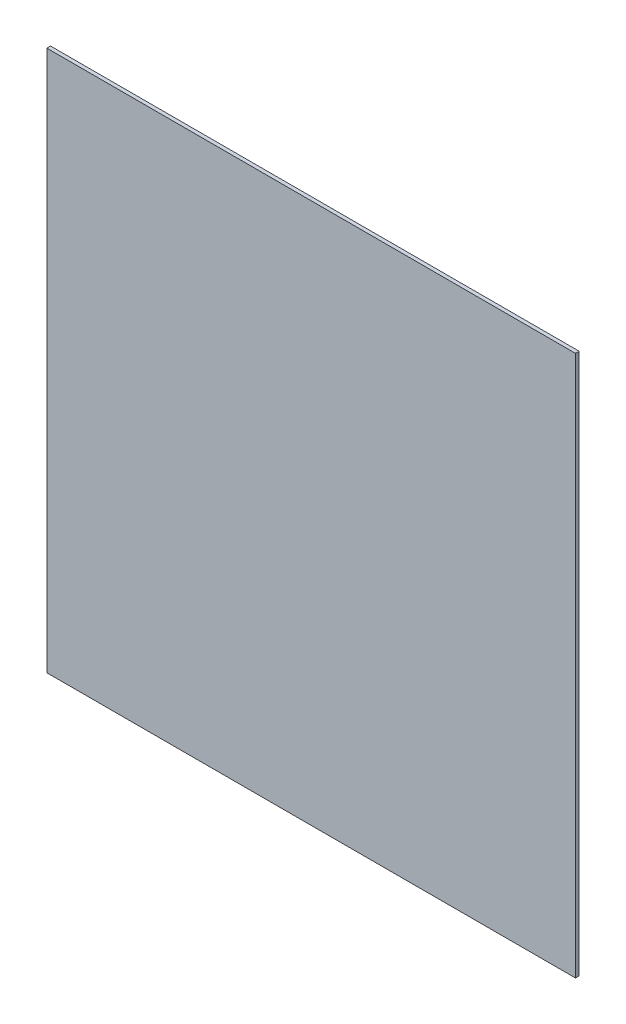
from build123d import *

# Parameters (mm, degrees)
SKETCH1_W           = 430
SKETCH1_H           = 440
BOSS_EXTRUDE1_DEPTH = 3


with BuildPart() as part:
    # Sketch1 → Boss-Extrude1 (new body)
    with BuildSketch(Plane.XY):
        Rectangle(SKETCH1_W, SKETCH1_H)
    extrude(amount=BOSS_EXTRUDE1_DEPTH)


solid = part.part
